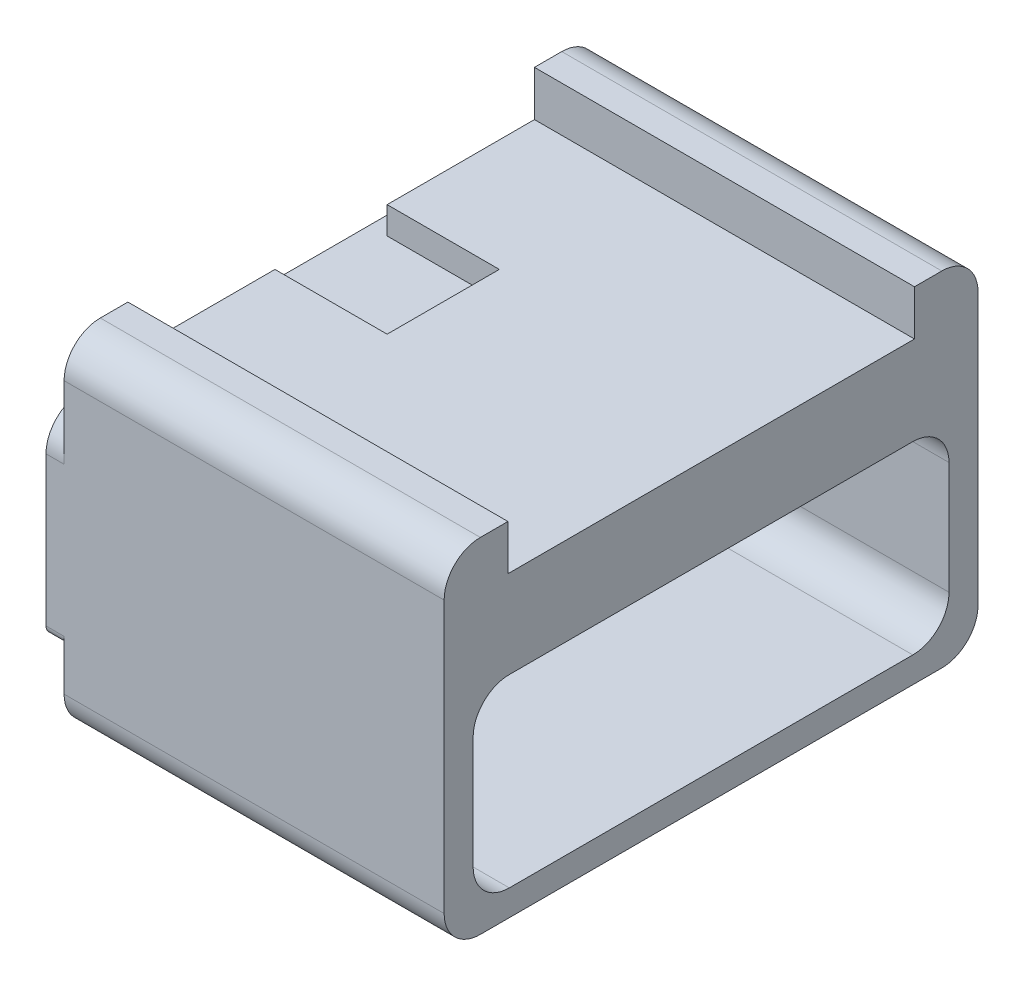
from build123d import *

# Parameters (mm, degrees)
BOSS_EXTRUDE1_DEPTH     = 21
SKETCH5_W               = 6.2
SKETCH5_H               = 6.2
CUT_EXTRUDE1_DEPTH      = 4
CUT_EXTRUDE2_DEPTH      = 28.364438602
CUT_EXTRUDE2_DEPTH_BACK = 28.364438602
SKETCH9_W               = 24.284850455
SKETCH9_H               = 22.464844075
CUT_EXTRUDE3_DEPTH      = 2.5
BOSS_EXTRUDE2_DEPTH     = 1


with BuildPart() as part:
    # Sketch3 → Boss-Extrude1 (new body)
    with BuildSketch(Plane(origin=(0, 0, 0), x_dir=(0, 0, -1), z_dir=(1, 0, 0))):
        with BuildLine():
            Line((-12.75, -9.5), (12.75, -9.5))
            ThreePointArc((12.75, -9.5), (14.164213562, -8.914213562), (14.75, -7.5))
            Line((14.75, -7.5), (14.75, 7.5))
            ThreePointArc((14.75, 7.5), (14.164213562, 8.914213562), (12.75, 9.5))
            Line((12.75, 9.5), (-12.75, 9.5))
            ThreePointArc((-12.75, 9.5), (-14.164213562, 8.914213562), (-14.75, 7.5))
            Line((-14.75, 7.5), (-14.75, -7.5))
            ThreePointArc((-14.75, -7.5), (-14.164213562, -8.914213562), (-12.75, -9.5))
        make_face()
    extrude(amount=BOSS_EXTRUDE1_DEPTH)

    # Sketch5 → Cut-Extrude1 (cut)
    with BuildSketch(Plane(origin=(0, 9.5, 0), x_dir=(1, 0, 0), z_dir=(0, 1, 0))):
        with Locations((3.1, 0)):
            Rectangle(SKETCH5_W, SKETCH5_H)
    extrude(amount=-CUT_EXTRUDE1_DEPTH, mode=Mode.SUBTRACT)

    # Sketch7 → Cut-Extrude2 (cut, two sides: drawn at the far end of the back side and taken through both)
    with BuildSketch(Plane.ZY.offset(-CUT_EXTRUDE2_DEPTH_BACK)):
        with BuildLine():
            Line((-11.147623693, -8.072928754), (11.147623693, -8.072928754))
            ThreePointArc((11.147623693, -8.072928754), (12.561837255, -7.487142316), (13.147623693, -6.072928754))
            Line((13.147623693, -6.072928754), (13.147623693, 0.135263404))
            ThreePointArc((13.147623693, 0.135263404), (12.561837255, 1.549476966), (11.147623693, 2.135263404))
            Line((11.147623693, 2.135263404), (-11.147623693, 2.135263404))
            ThreePointArc((-11.147623693, 2.135263404), (-12.561837255, 1.549476966), (-13.147623693, 0.135263404))
            Line((-13.147623693, 0.135263404), (-13.147623693, -6.072928754))
            ThreePointArc((-13.147623693, -6.072928754), (-12.561837255, -7.487142316), (-11.147623693, -8.072928754))
        make_face()
    extrude(amount=CUT_EXTRUDE2_DEPTH + CUT_EXTRUDE2_DEPTH_BACK, mode=Mode.SUBTRACT)

    # Sketch9 → Cut-Extrude3 (cut)
    with BuildSketch(Plane(origin=(0, 9.5, 0), x_dir=(1, 0, 0), z_dir=(0, 1, 0))):
        with Locations((12.142425228, 0.007615305)):
            Rectangle(SKETCH9_W, SKETCH9_H)
    extrude(amount=-CUT_EXTRUDE3_DEPTH, mode=Mode.SUBTRACT)

    # Sketch11 → Boss-Extrude2 (add)
    with BuildSketch(Plane.ZY):
        with BuildLine():
            Line((-13.647623693, -5.23512894), (-14.25, -5.23512894))
            ThreePointArc((-14.25, -5.23512894), (-14.603553391, -5.088682331), (-14.75, -4.73512894))
            Line((-14.75, -4.73512894), (-14.75, 3.5))
            ThreePointArc((-14.75, 3.5), (-14.164213562, 4.914213562), (-12.75, 5.5))
            Line((-12.75, 5.5), (12.75, 5.5))
            ThreePointArc((12.75, 5.5), (14.164213562, 4.914213562), (14.75, 3.5))
            Line((14.75, 3.5), (14.75, -4.73512894))
            ThreePointArc((14.75, -4.73512894), (14.603553391, -5.088682331), (14.25, -5.23512894))
            Line((14.25, -5.23512894), (13.647623693, -5.23512894))
            ThreePointArc((13.647623693, -5.23512894), (13.294070302, -5.088682331), (13.147623693, -4.73512894))
            Line((13.147623693, -4.73512894), (13.147623693, 0.135263404))
            ThreePointArc((13.147623693, 0.135263404), (12.561837255, 1.549476966), (11.147623693, 2.135263404))
            Line((11.147623693, 2.135263404), (-11.147623693, 2.135263404))
            ThreePointArc((-11.147623693, 2.135263404), (-12.561837255, 1.549476966), (-13.147623693, 0.135263404))
            Line((-13.147623693, 0.135263404), (-13.147623693, -4.73512894))
            ThreePointArc((-13.147623693, -4.73512894), (-13.294070302, -5.088682331), (-13.647623693, -5.23512894))
        make_face()
    extrude(amount=BOSS_EXTRUDE2_DEPTH)


solid = part.part
